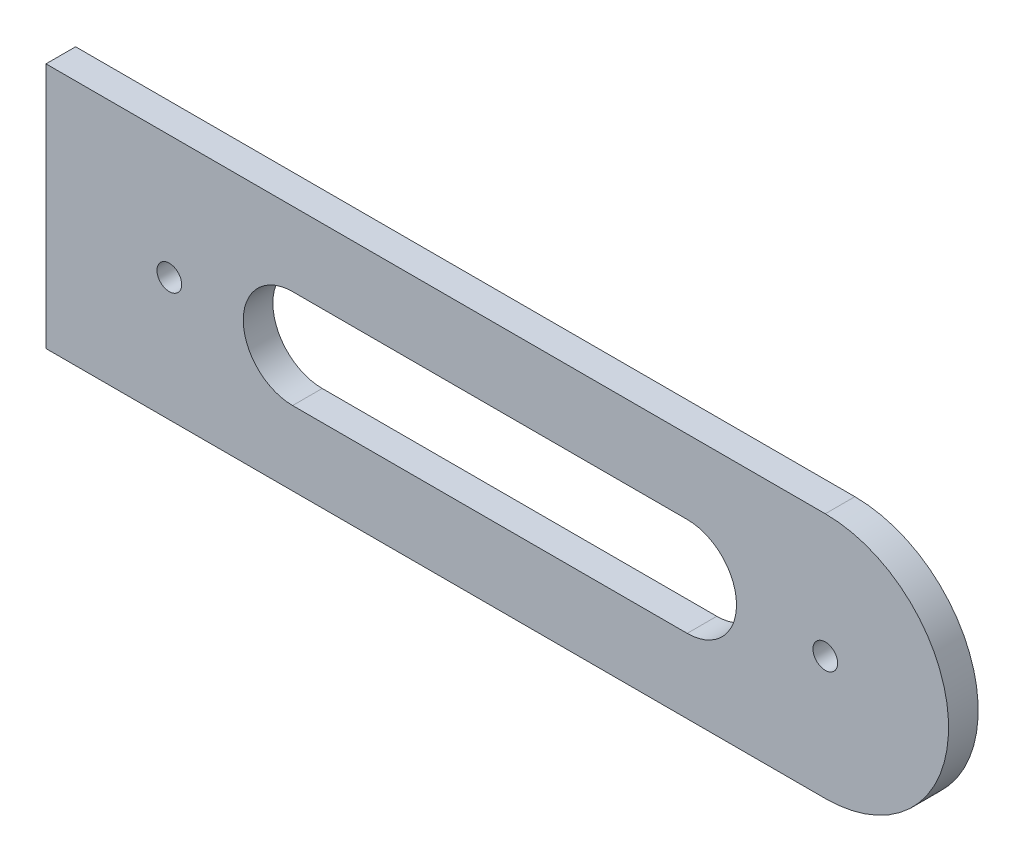
from build123d import *

# Parameters (mm, degrees)
SKETCH1_R           = 2.5
BOSS_EXTRUDE1_DEPTH = 6


with BuildPart() as part:
    # Sketch1 → Boss-Extrude1 (new body)
    with BuildSketch(Plane.XY):
        with BuildLine():
            Line((0, -50), (158, -50))
            ThreePointArc((158, -50), (183, -25), (158, 0))
            Line((158, 0), (0, 0))
            Line((0, 0), (0, -50))
        make_face()
        with Locations((25, -25)):
            Circle(SKETCH1_R, mode=Mode.SUBTRACT)
        with Locations((158, -25)):
            Circle(SKETCH1_R, mode=Mode.SUBTRACT)
        with BuildLine():
            Line((50, -35), (130, -35))
            ThreePointArc((130, -35), (140, -25), (130, -15))
            Line((130, -15), (50, -15))
            ThreePointArc((50, -15), (40, -25), (50, -35))
        make_face(mode=Mode.SUBTRACT)
    extrude(amount=BOSS_EXTRUDE1_DEPTH)


solid = part.part
